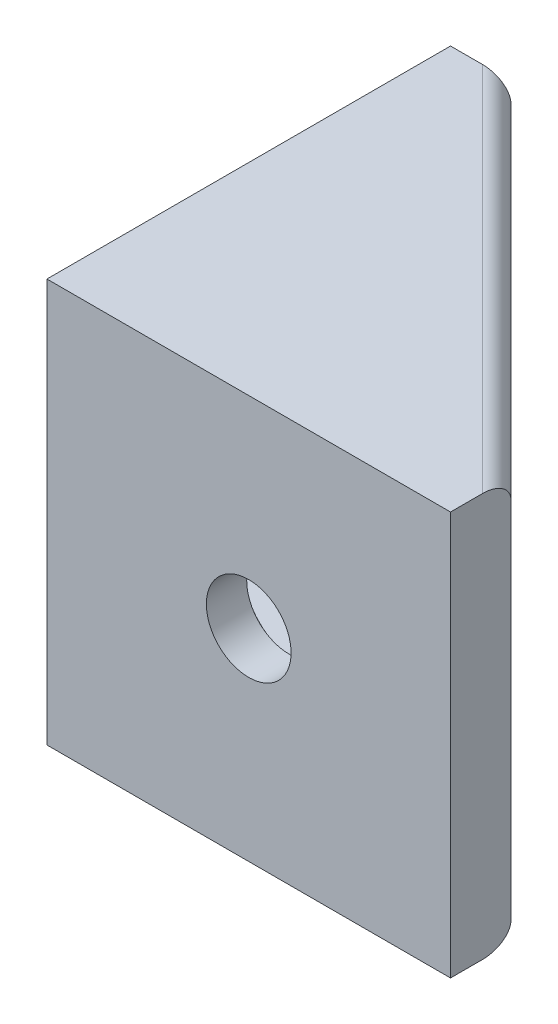
from build123d import *

# Parameters (mm, degrees)
EXTRUDE_1_DEPTH     = 20
EXTRUDE_2_DEPTH     = 3
EXTRUDE_3_DEPTH     = 3
CHAMFER_1_SIZE      = 10
SKETCH_4_R          = 2.1
CUT_EXTRUDE_1_DEPTH = 3
CUT_EXTRUDE_2_DEPTH = 10
FILLET_1_R          = 1
SKETCH_6_R          = 2.1
CUT_EXTRUDE_3_DEPTH = 10
SKETCH_7_R          = 3.5
CUT_EXTRUDE_4_DEPTH = 10
SKETCH_8_W          = 10
SKETCH_8_H          = 10
CUT_EXTRUDE_5_DEPTH = 7
FILLET_2_R          = 1
SKETCH_9_R          = 3.5
CUT_EXTRUDE_6_DEPTH = 1
SKETCH_10_R         = 3.5
CUT_EXTRUDE_7_DEPTH = 1


with BuildPart() as part:
    # 草图1 → 凸台-拉伸1 (new body)
    with BuildSketch(Plane(origin=(0, 0, 0), x_dir=(1, 0, 0), z_dir=(0, 1, 0))):
        Polygon((0, 20), (0, 0), (20, 0), (20, 3), (3, 3), (3, 20), align=None)
    extrude(amount=EXTRUDE_1_DEPTH)

    # 草图2 → 凸台-拉伸2 (add)
    with BuildSketch(Plane(origin=(0, 20, 0), x_dir=(1, 0, 0), z_dir=(0, 1, 0))):
        Polygon((3, 20), (20, 3), (3, 3), align=None)
    extrude(amount=-EXTRUDE_2_DEPTH)

    # 草图3 → 凸台-拉伸3 (add)
    with BuildSketch(Plane.XZ):
        Polygon((20, -3), (3, -20), (3, -3), align=None)
    extrude(amount=-EXTRUDE_3_DEPTH)

    # 倒角1
    chamfer_1_edges = [part.edges().sort_by_distance(p)[0] for p in [
        (3, 10, -3),
    ]]
    chamfer(chamfer_1_edges, length=CHAMFER_1_SIZE)

    # 草图4 → 切除-拉伸1 (cut)
    with BuildSketch(Plane(origin=(0, 0, -3), x_dir=(-1, 0, 0), z_dir=(0, 0, -1))):
        with Locations((-10, 10)):
            Circle(SKETCH_4_R)
    extrude(amount=-CUT_EXTRUDE_1_DEPTH, mode=Mode.SUBTRACT)

    # 草图5 → 切除-拉伸2 (cut)
    with BuildSketch(Plane(origin=(0, 0, -3), x_dir=(-1, 0, 0), z_dir=(0, 0, -1))):
        with BuildLine():
            Line((-10, 13.5), (-13, 13.5))
            Line((-13, 13.5), (-13, 6.5))
            Line((-13, 6.5), (-10, 6.5))
            ThreePointArc((-10, 6.5), (-6.5, 10), (-10, 13.5))
        make_face()
    extrude(amount=CUT_EXTRUDE_2_DEPTH, mode=Mode.SUBTRACT)

    # 圆角1
    fillet_1_edges = [part.edges().sort_by_distance(p)[0] for p in [
        (11.5, 20, -11.5),
        (11.5, 0, -11.5),
    ]]
    fillet(fillet_1_edges, radius=FILLET_1_R)

    # 草图6 → 切除-拉伸3 (cut)
    with BuildSketch(Plane(origin=(3, 0, 0), x_dir=(0, 0, -1), z_dir=(1, 0, 0))):
        with Locations((10, 10)):
            Circle(SKETCH_6_R)
    extrude(amount=-CUT_EXTRUDE_3_DEPTH, mode=Mode.SUBTRACT)

    # 草图7 → 切除-拉伸4 (cut)
    with BuildSketch(Plane.ZY.offset(-3)):
        with Locations((-10, 10)):
            Circle(SKETCH_7_R)
    extrude(amount=-CUT_EXTRUDE_4_DEPTH, mode=Mode.SUBTRACT)

    # 草图8 → 切除-拉伸5 (cut)
    with BuildSketch(Plane.XZ.offset(-13.5)):
        with Locations((8, -8)):
            Rectangle(SKETCH_8_W, SKETCH_8_H)
    extrude(amount=CUT_EXTRUDE_5_DEPTH, mode=Mode.SUBTRACT)

    # 圆角2
    fillet_2_edges = [part.edges().sort_by_distance(p)[0] for p in [
        (8, 3, -8),
        (8, 17, -8),
        (8, 13.5, -8),
        (8, 6.5, -8),
    ]]
    fillet(fillet_2_edges, radius=FILLET_2_R)

    # 草图9 → 切除-拉伸6 (cut)
    with BuildSketch(Plane(origin=(0, 0, -3), x_dir=(-1, 0, 0), z_dir=(0, 0, -1))):
        with Locations((-10, 10)):
            Circle(SKETCH_9_R)
    extrude(amount=-CUT_EXTRUDE_6_DEPTH, mode=Mode.SUBTRACT)

    # 草图10 → 切除-拉伸7 (cut)
    with BuildSketch(Plane(origin=(3, 0, 0), x_dir=(0, 0, -1), z_dir=(1, 0, 0))):
        with Locations((10, 10)):
            Circle(SKETCH_10_R)
    extrude(amount=-CUT_EXTRUDE_7_DEPTH, mode=Mode.SUBTRACT)


solid = part.part
